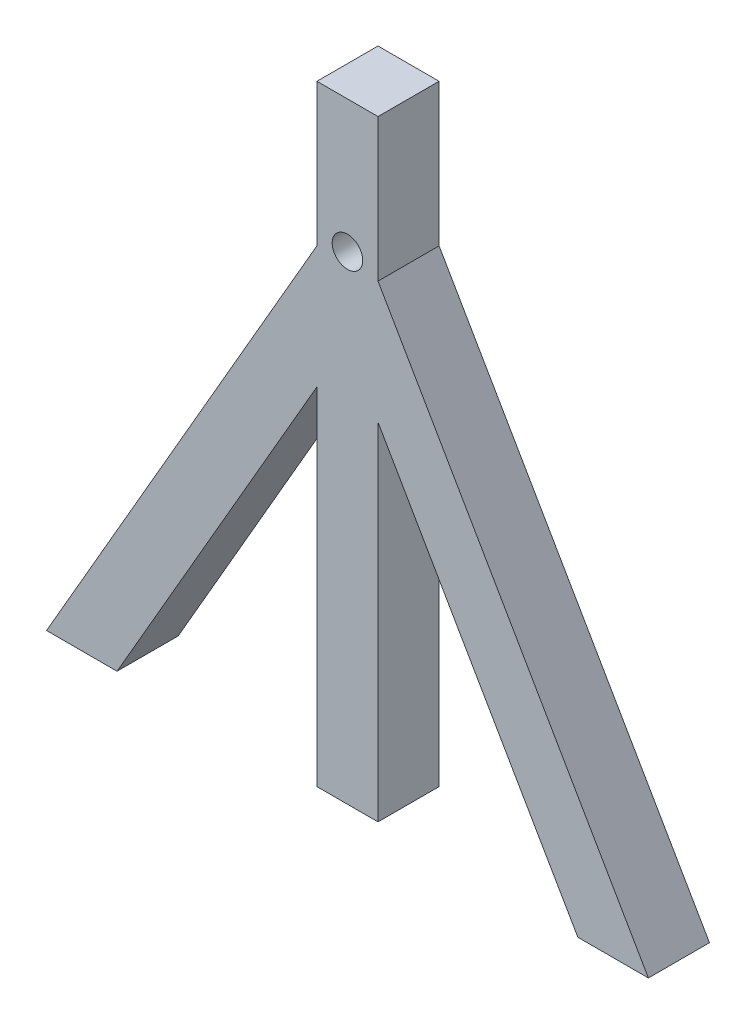
from build123d import *

# Parameters (mm, degrees)
BOSS_EXTRUDE1_DEPTH = 30
SKETCH2_R           = 7.5
CUT_EXTRUDE1_DEPTH  = 213.701786995


with BuildPart() as part:
    # Sketch1 → Boss-Extrude1 (new body)
    with BuildSketch(Plane.XY):
        Polygon((-15, 20), (-113.149545762, -150), (-147.790561914, -150), (-15, 80), (-15, 150), (15, 150), (15, 80), (147.790561914, -150), (113.149545762, -150), (15, 20), (15, -150), (-15, -150), align=None)
    extrude(amount=BOSS_EXTRUDE1_DEPTH)

    # Sketch2 → Cut-Extrude1 (cut, through all)
    with BuildSketch(Plane.XY.offset(30)):
        with Locations((0, 85)):
            Circle(SKETCH2_R)
    extrude(amount=-CUT_EXTRUDE1_DEPTH, mode=Mode.SUBTRACT)


solid = part.part
